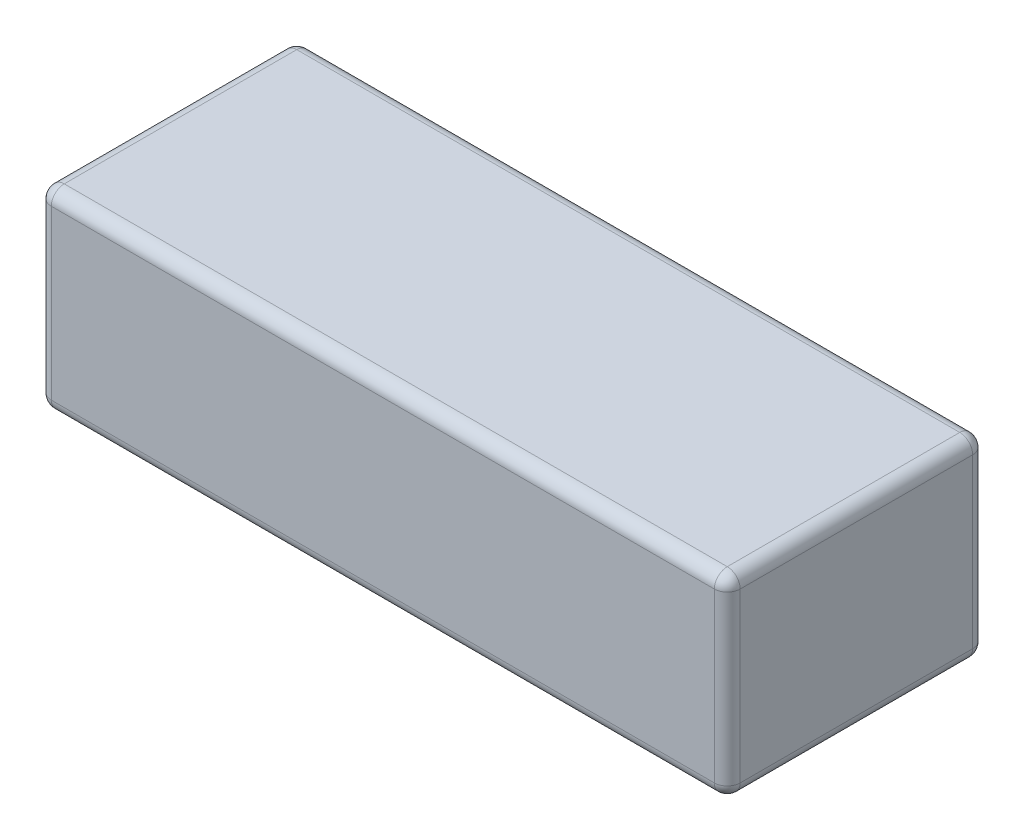
from build123d import *

# Parameters (mm, degrees)
SKETCH_1_W      = 160
SKETCH_1_H      = 45
EXTRUDE_1_DEPTH = 60
FILLET_1_R      = 3


with BuildPart() as part:
    # 草图1 → 凸台-拉伸1 (new body)
    with BuildSketch(Plane.XY):
        with Locations((80, -22.5)):
            Rectangle(SKETCH_1_W, SKETCH_1_H)
    extrude(amount=EXTRUDE_1_DEPTH)

    # 圆角1
    fillet_1_edges = [part.edges().sort_by_distance(p)[0] for p in [
        (160, -22.5, 60),
        (80, 0, 60),
        (0, -22.5, 60),
        (80, 0, 0),
        (160, -22.5, 0),
        (80, -45, 0),
        (0, -22.5, 0),
        (0, 0, 30),
        (160, 0, 30),
        (160, -45, 30),
        (0, -45, 30),
        (80, -45, 60),
    ]]
    fillet(fillet_1_edges, radius=FILLET_1_R)


solid = part.part
